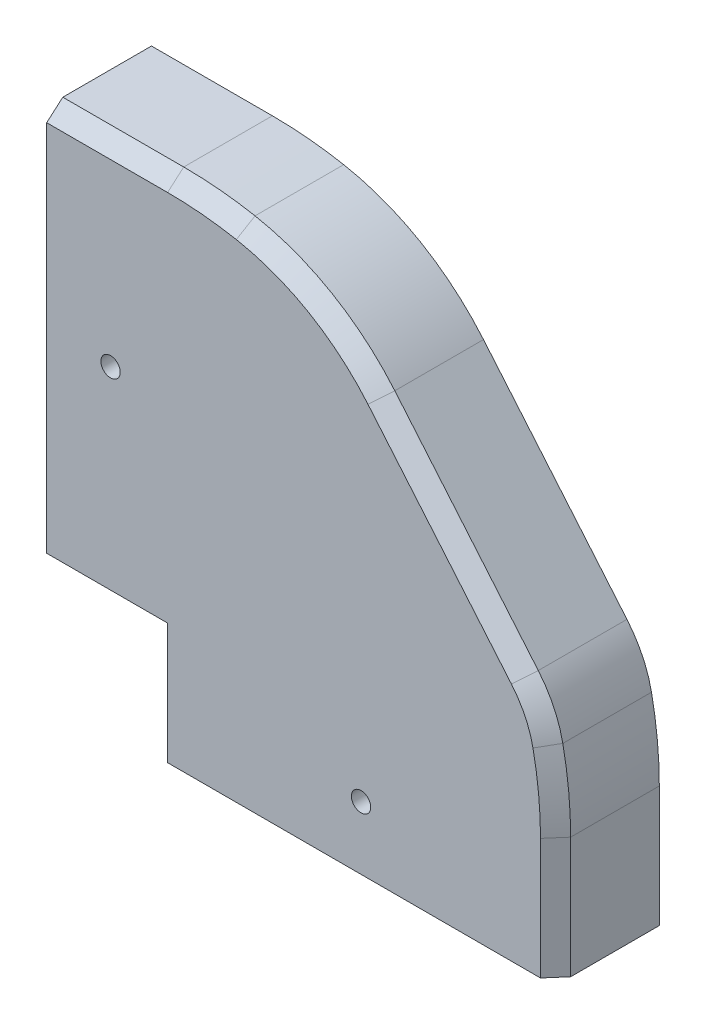
from build123d import *
from OCP.BRepFilletAPI import BRepFilletAPI_MakeChamfer

# Parameters (mm, degrees)
SKETCH1_W           = 60.96
SKETCH1_H           = 16.51
SKETCH1_W_2         = 50.8
SKETCH1_H_2         = 6.35
BOSS_EXTRUDE1_DEPTH = 19.05
BOSS_EXTRUDE2_DEPTH = 16.51
SKETCH5_R           = 1.524
CUT_EXTRUDE1_DEPTH  = 96.537432978
CHAMFER1_SIZE       = 2.1082
CHAMFER1_SIZE2      = 1.832630301
FILLET1_R           = 18.034
CHAMFER2_SIZE       = 2.54
CHAMFER2_SIZE2      = 2.207988314
SKETCH6_W           = 52.07
SKETCH6_H           = 7.62
CUT_EXTRUDE2_DEPTH  = 19.05
SKETCH7_W           = 7.62
SKETCH7_H           = 52.07
CUT_EXTRUDE3_DEPTH  = 19.05


with BuildPart() as part:
    # Sketch1 → Boss-Extrude1 (new body)
    with BuildSketch(Plane(origin=(0, 0, 0), x_dir=(1, 0, 0), z_dir=(0, 1, 0))):
        Rectangle(SKETCH1_W, SKETCH1_H)
        Rectangle(SKETCH1_W_2, SKETCH1_H_2, mode=Mode.SUBTRACT)
    boss_extrude1 = extrude(amount=BOSS_EXTRUDE1_DEPTH)

    # Sketch2 → Boss-Extrude2 (add)
    with BuildSketch(Plane.XY.offset(8.255)):
        with BuildLine():
            Line((-30.48, 19.05), (-30.48, 80.01))
            ThreePointArc((-30.48, 80.01), (12.625229381, 62.155229381), (30.48, 19.05))
            Line((30.48, 19.05), (-30.48, 19.05))
        make_face()
    extrude(amount=-BOSS_EXTRUDE2_DEPTH)

    # Mirror1: Boss-Extrude1 across plane
    add(boss_extrude1.mirror(Plane(origin=(-24.765, 24.765, 0), x_dir=(0, 0, 1), z_dir=(-0.7071067811865488, 0.7071067811865464, 0))))

    # Sketch5 → Cut-Extrude1 (cut, through all)
    with BuildSketch(Plane(origin=(0, 0, -8.255), x_dir=(-1, 0, 0), z_dir=(0, 0, -1))):
        with Locations((0, 9.917240348)):
            Circle(SKETCH5_R)
        with Locations((39.468758027, 49.53)):
            Circle(SKETCH5_R)
        with BuildLine():
            Line((-2.778172553, 66.109095279), (-28.061671506, 36.049832271))
            ThreePointArc((-28.061671506, 36.049832271), (-10.480017479, 64.198627533), (19.242304668, 78.965238493))
            ThreePointArc((19.242304668, 78.965238493), (7.11859344, 74.444363935), (-2.778172553, 66.109095279))
        make_face()
    extrude(amount=-CUT_EXTRUDE1_DEPTH, mode=Mode.SUBTRACT)

    # Chamfer1
    chamfer1_edges = [part.edges().sort_by_distance(p)[0] for p in [
        (1.524, 9.917240348, -8.255),
        (-37.944758027, 49.53, -8.255),
    ]]
    chamfer1_side = [part.faces().sort_by_distance(p)[0] for p in [
        (-12.284487688, 37.419339753, -8.255),
    ]]
    chamfer(chamfer1_edges, length=CHAMFER1_SIZE, length2=CHAMFER1_SIZE2, reference=chamfer1_side[0])

    # Fillet1
    fillet1_edges = [part.edges().sort_by_distance(p)[0] for p in [
        (28.061671506, 36.049832271, 0),
    ]]
    fillet(fillet1_edges, radius=FILLET1_R)

    # Chamfer2: one chamfer whose edges measure the first distance from different faces: ONE call of the kernel's chamfer builder (chamfer() names one face for all edges)
    chamfer2_edges_1 = [part.edges().sort_by_distance(p)[0] for p in [
        (14.079711572, 52.672824674, 8.255),
    ]]
    chamfer2_side_1 = [part.faces().sort_by_distance(p)[0] for p in [
        (14.079711572, 52.672824674, 0),
    ]]
    chamfer2_edges_2 = [part.edges().sort_by_distance(p)[0] for p in [
        (27.816828301, 35.476442899, 8.255),
    ]]
    chamfer2_side_2 = [part.faces().sort_by_distance(p)[0] for p in [
        (27.816828301, 35.476442899, 0),
    ]]
    chamfer2_edges_3 = [part.edges().sort_by_distance(p)[0] for p in [
        (30.171820892, 25.171945968, 8.255),
    ]]
    chamfer2_side_3 = [part.faces().sort_by_distance(p)[0] for p in [
        (30.171820892, 25.171945968, 0),
    ]]
    chamfer2_edges_4 = [part.edges().sort_by_distance(p)[0] for p in [
        (-40.005, 80.01, 8.255),
    ]]
    chamfer2_side_4 = [part.faces().sort_by_distance(p)[0] for p in [
        (-40.005, 80.01, 0),
    ]]
    chamfer2_edges_5 = [part.edges().sort_by_distance(p)[0] for p in [
        (30.48, 9.525, 8.255),
    ]]
    chamfer2_side_5 = [part.faces().sort_by_distance(p)[0] for p in [
        (30.48, 9.525, 0),
    ]]
    chamfer2_edges_6 = [part.edges().sort_by_distance(p)[0] for p in [
        (-24.836921873, 79.748247662, 8.255),
    ]]
    chamfer2_side_6 = [part.faces().sort_by_distance(p)[0] for p in [
        (-24.836921873, 79.748247662, 0),
    ]]
    chamfer2_edges_7 = [part.edges().sort_by_distance(p)[0] for p in [
        (-7.11859344, 74.444363935, 8.255),
    ]]
    chamfer2_side_7 = [part.faces().sort_by_distance(p)[0] for p in [
        (-7.11859344, 74.444363935, 0),
    ]]
    chamfer2 = BRepFilletAPI_MakeChamfer(part.part.solid().wrapped)
    for e in chamfer2_edges_1:
        chamfer2.Add(CHAMFER2_SIZE, CHAMFER2_SIZE2, e.wrapped, chamfer2_side_1[0].wrapped)  # the first distance lies on this face
    for e in chamfer2_edges_2:
        chamfer2.Add(CHAMFER2_SIZE, CHAMFER2_SIZE2, e.wrapped, chamfer2_side_2[0].wrapped)  # the first distance lies on this face
    for e in chamfer2_edges_3:
        chamfer2.Add(CHAMFER2_SIZE, CHAMFER2_SIZE2, e.wrapped, chamfer2_side_3[0].wrapped)  # the first distance lies on this face
    for e in chamfer2_edges_4:
        chamfer2.Add(CHAMFER2_SIZE, CHAMFER2_SIZE2, e.wrapped, chamfer2_side_4[0].wrapped)  # the first distance lies on this face
    for e in chamfer2_edges_5:
        chamfer2.Add(CHAMFER2_SIZE, CHAMFER2_SIZE2, e.wrapped, chamfer2_side_5[0].wrapped)  # the first distance lies on this face
    for e in chamfer2_edges_6:
        chamfer2.Add(CHAMFER2_SIZE, CHAMFER2_SIZE2, e.wrapped, chamfer2_side_6[0].wrapped)  # the first distance lies on this face
    for e in chamfer2_edges_7:
        chamfer2.Add(CHAMFER2_SIZE, CHAMFER2_SIZE2, e.wrapped, chamfer2_side_7[0].wrapped)  # the first distance lies on this face
    add(Compound.cast(chamfer2.Shape()), mode=Mode.REPLACE)

    # Sketch6 → Cut-Extrude2 (cut)
    with BuildSketch(Plane.XZ):
        Rectangle(SKETCH6_W, SKETCH6_H)
    extrude(amount=-CUT_EXTRUDE2_DEPTH, mode=Mode.SUBTRACT)

    # Sketch7 → Cut-Extrude3 (cut)
    with BuildSketch(Plane.ZY.offset(49.53)):
        with Locations((0, 49.53)):
            Rectangle(SKETCH7_W, SKETCH7_H)
    extrude(amount=-CUT_EXTRUDE3_DEPTH, mode=Mode.SUBTRACT)


solid = part.part
